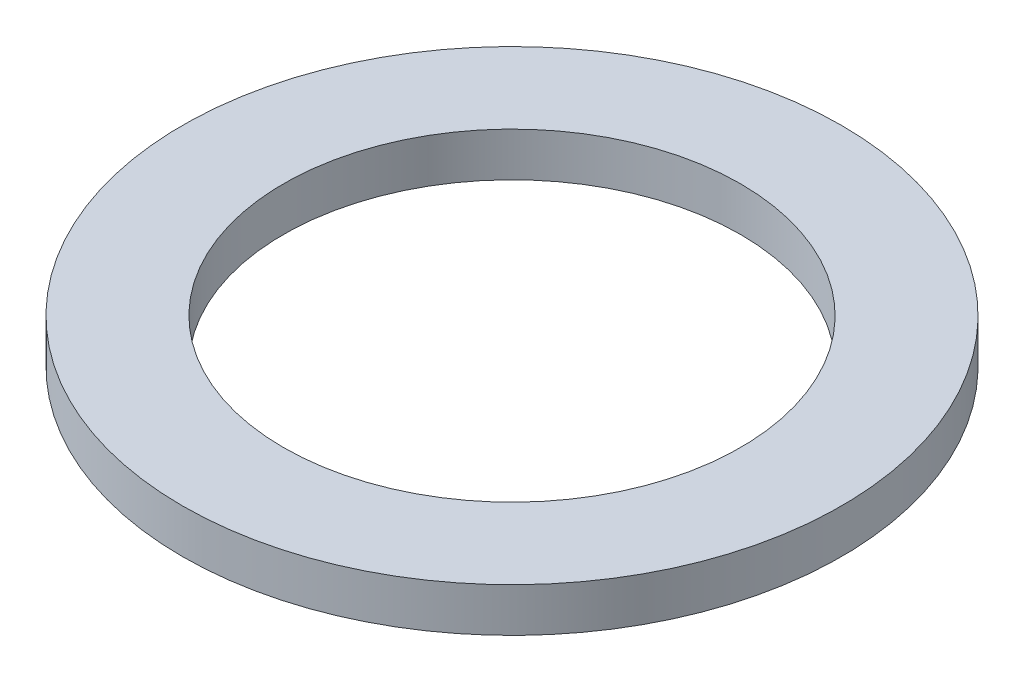
from build123d import *

# Parameters (mm, degrees)
SKETCH_1_R      = 7.5
SKETCH_1_R_2    = 5.2
EXTRUDE_1_DEPTH = 1


with BuildPart() as part:
    # 草图1 → 凸台-拉伸1 (new body)
    with BuildSketch(Plane(origin=(0, 0, 0), x_dir=(1, 0, 0), z_dir=(0, 1, 0))):
        with Locations(Location((0, 0, 0), (0, 0, 270))):
            Circle(SKETCH_1_R)
        with Locations(Location((0, 0, 0), (0, 0, 270))):
            Circle(SKETCH_1_R_2, mode=Mode.SUBTRACT)
    extrude(amount=EXTRUDE_1_DEPTH)


solid = part.part
